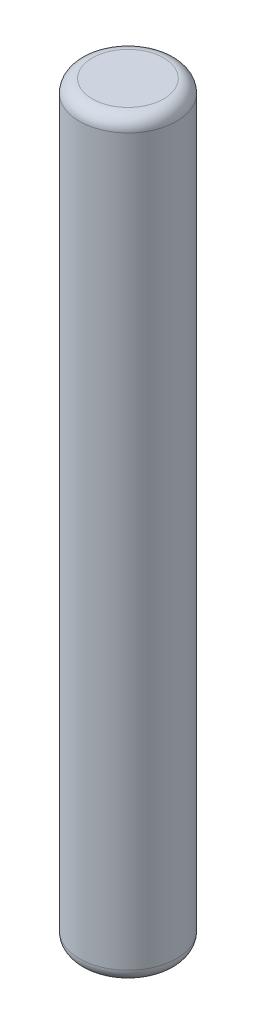
from build123d import *

# Parameters (mm, degrees)
SKETCH_1_R      = 0.375
EXTRUDE_1_DEPTH = 5.8
FILLET_1_R      = 0.1


with BuildPart() as part:
    # Эскиз1 → Бобышка-Вытянуть1 (new body)
    with BuildSketch(Plane(origin=(0, 0, 0), x_dir=(1, 0, 0), z_dir=(0, 1, 0))):
        with Locations(Location((0, 0, 0), (0, 0, 270))):
            Circle(SKETCH_1_R)
    extrude(amount=EXTRUDE_1_DEPTH)

    # Скругление1
    fillet_1_edges = [part.edges().sort_by_distance(p)[0] for p in [
        (0, 0, -0.375),
        (0, 5.8, -0.375),
    ]]
    fillet(fillet_1_edges, radius=FILLET_1_R)


solid = part.part
